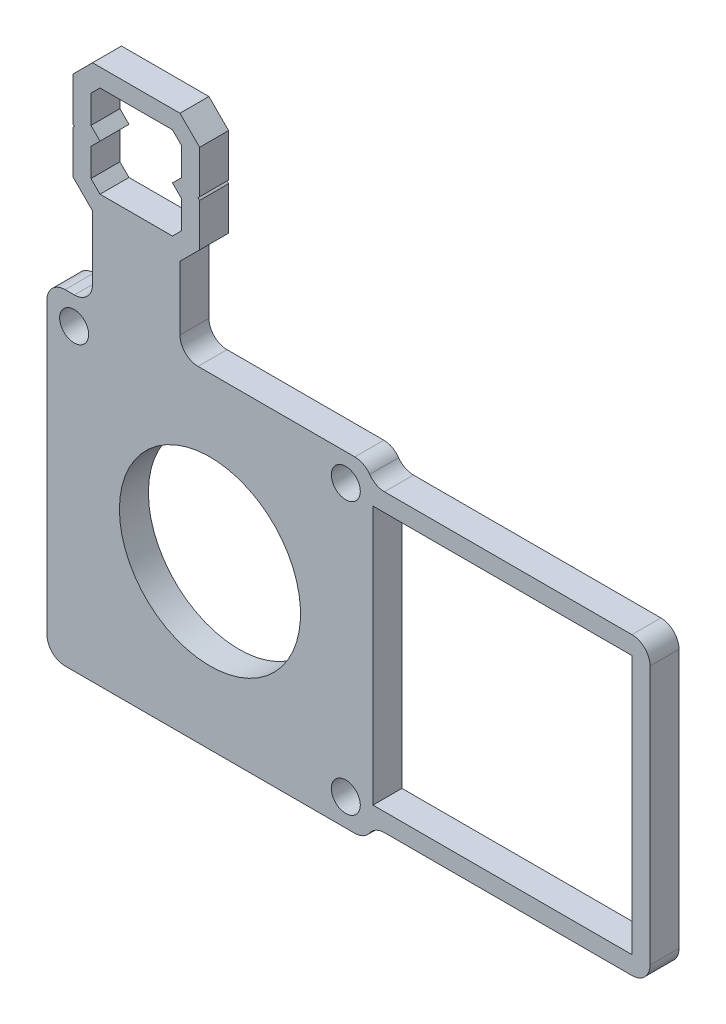
from build123d import *

# Parameters (mm, degrees)
SKETCH2_R           = 5
BOSS_EXTRUDE1_DEPTH = 1.6
SKETCH4_R           = 0.8
CUT_EXTRUDE1_DEPTH  = 32.900742651
FILLET1_R           = 1


with BuildPart() as part:
    # Sketch2 → Boss-Extrude1 (new body)
    # profile 1 of 3: a face of its own
    with BuildSketch(Plane(origin=(0, 0, -5.6), x_dir=(-1, 0, 0), z_dir=(0, 0, -1))):
        with BuildLine():
            Line((-9, -8), (-9, -7.15))
            Line((-9, -7.15), (-23.3, -7.15))
            Line((-23.3, -7.15), (-23.3, 7.15))
            Line((-23.3, 7.15), (-9, 7.15))
            Line((-9, 7.15), (-9, 8))
            ThreePointArc((-9, 8), (-8.95345514, 8.3015349), (-8.818153409, 8.575))
            ThreePointArc((-8.818153409, 8.575), (-9.175329594, 8.262588033), (-9.636306817, 8.15))
            Line((-9.636306817, 8.15), (-24.3, 8.15))
            Line((-24.3, 8.15), (-24.3, -8.15))
            Line((-24.3, -8.15), (-9.636306817, -8.15))
            ThreePointArc((-9.636306817, -8.15), (-9.175329594, -8.262588033), (-8.818153409, -8.575))
            ThreePointArc((-8.818153409, -8.575), (-8.95345514, -8.3015349), (-9, -8))
        make_face()
    # profile 2 of 3: a face of its own
    with BuildSketch(Plane(origin=(0, 0, -5.6), x_dir=(-1, 0, 0), z_dir=(0, 0, -1))):
        with BuildLine():
            Line((-9, 7.15), (-9, -7.15))
            Line((-9, -7.15), (-9, -8))
            ThreePointArc((-9, -8), (-8.95345514, -8.3015349), (-8.818153409, -8.575))
            ThreePointArc((-8.818153409, -8.575), (-8.460977223, -8.887411967), (-8, -9))
            Line((-8, -9), (-2, -9))
            Line((-2, -9), (2, -9))
            Line((2, -9), (8, -9))
            ThreePointArc((8, -9), (8.707106781, -8.707106781), (9, -8))
            Line((9, -8), (9, -2))
            Line((9, -2), (9, 2))
            Line((9, 2), (9, 8))
            ThreePointArc((9, 8), (8.707106781, 8.707106781), (8, 9))
            Line((8, 9), (7.485413277, 9))
            Line((7.485413277, 9), (0.656986152, 9))
            Line((0.656986152, 9), (-2, 9))
            Line((-2, 9), (-8, 9))
            ThreePointArc((-8, 9), (-8.460977223, 8.887411967), (-8.818153409, 8.575))
            ThreePointArc((-8.818153409, 8.575), (-8.95345514, 8.3015349), (-9, 8))
            Line((-9, 8), (-9, 7.15))
        make_face()
        Circle(SKETCH2_R, mode=Mode.SUBTRACT)
    # profile 3 of 3: a face of its own
    with BuildSketch(Plane(origin=(0, 0, -5.6), x_dir=(-1, 0, 0), z_dir=(0, 0, -1))):
        with BuildLine():
            ThreePointArc((1.656986152, 10), (1.364092933, 9.292893219), (0.656986152, 9))
            Line((0.656986152, 9), (7.485413277, 9))
            ThreePointArc((7.485413277, 9), (6.778306496, 9.292893219), (6.485413277, 10))
            Line((6.485413277, 10), (6.485413277, 13.526003096))
            Line((6.485413277, 13.526003096), (7.571199814, 14.611789435))
            Line((7.571199814, 14.611789435), (7.571200029, 16.980216561))
            Line((7.571200029, 16.980216561), (7.4854136, 17.066003006))
            Line((7.4854136, 17.066003006), (7.571200045, 17.151789436))
            Line((7.571200045, 17.151789436), (7.57120026, 19.52021656))
            Line((7.57120026, 19.52021656), (6.485413922, 20.606003096))
            Line((6.485413922, 20.606003096), (1.656986797, 20.606003536))
            Line((1.656986797, 20.606003536), (0.57120026, 19.520217197))
            Line((0.57120026, 19.520217197), (0.571200045, 17.151790072))
            Line((0.571200045, 17.151790072), (0.656986475, 17.066003626))
            Line((0.656986475, 17.066003626), (0.571200029, 16.980217196))
            Line((0.571200029, 16.980217196), (0.571199814, 14.611790072))
            Line((0.571199814, 14.611790072), (1.656986152, 13.526003536))
            Line((1.656986152, 13.526003536), (1.656986152, 10))
        make_face()
        Polygon((1.571199851, 15.026003543), (1.571199991, 16.566003543), (2.071200036, 17.066003498), (1.571200082, 17.566003543), (1.571200223, 19.106003543), (2.071200268, 19.606003498), (6.071200269, 19.606003133), (6.571200223, 19.106003089), (6.571200082, 17.566003089), (6.071200038, 17.066003133), (6.571199991, 16.566003089), (6.571199851, 15.026003089), (6.071199806, 14.526003134), (2.071199805, 14.526003498), align=None, mode=Mode.SUBTRACT)
    extrude(amount=-BOSS_EXTRUDE1_DEPTH)

    # Sketch4 → Cut-Extrude1 (cut, through all)
    with BuildSketch(Plane(origin=(0, 0, -5.6), x_dir=(-1, 0, 0), z_dir=(0, 0, -1))):
        with Locations((-7.5, 7.5)):
            Circle(SKETCH4_R)
        with Locations((-7.5, -7.5)):
            Circle(SKETCH4_R)
        with Locations((7.5, 7.5)):
            Circle(SKETCH4_R)
    extrude(amount=-CUT_EXTRUDE1_DEPTH, mode=Mode.SUBTRACT)

    # Fillet1
    fillet1_edges = [part.edges().sort_by_distance(p)[0] for p in [
        (24.3, -8.15, -4.8),
        (24.3, 8.15, -4.8),
    ]]
    fillet(fillet1_edges, radius=FILLET1_R)


solid = part.part
